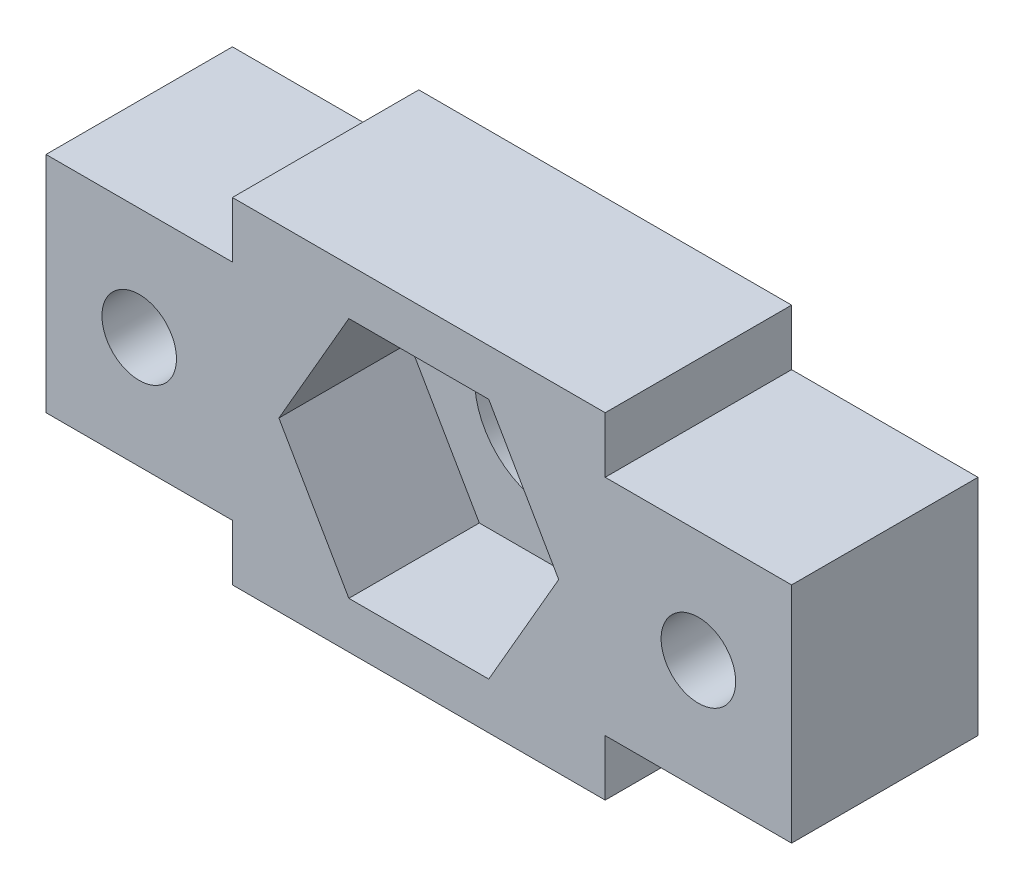
from build123d import *

# Parameters (mm, degrees)
SKETCH1_W           = 40
SKETCH1_H           = 12
SKETCH1_R           = 2
SKETCH1_R_2         = 4
BOSS_EXTRUDE1_DEPTH = 3
SKETCH2_W           = 20
SKETCH2_H           = 18
BOSS_EXTRUDE2_DEPTH = 7
SKETCH2_4_W         = 20
SKETCH2_4_H         = 18
BOSS_EXTRUDE3_DEPTH = 3
SKETCH3_W           = 10
SKETCH3_H           = 12
SKETCH3_R           = 2
BOSS_EXTRUDE4_DEPTH = 7
BOSS_EXTRUDE5_DEPTH = 3


with BuildPart() as part:
    # Sketch1 → Boss-Extrude1 (new body)
    with BuildSketch(Plane.XY):
        with Locations((-60, -25)):
            Rectangle(SKETCH1_W, SKETCH1_H)
        with Locations((-45, -25)):
            Circle(SKETCH1_R, mode=Mode.SUBTRACT)
        with Locations((-75, -25)):
            Circle(SKETCH1_R, mode=Mode.SUBTRACT)
        with Locations((-60, -25)):
            Circle(SKETCH1_R_2, mode=Mode.SUBTRACT)
    extrude(amount=BOSS_EXTRUDE1_DEPTH)

    # Sketch2 → Boss-Extrude2 (add)
    with BuildSketch(Plane.XY.offset(3)):
        with Locations((-60, -25)):
            Rectangle(SKETCH2_W, SKETCH2_H)
        Polygon((-56.24722325, -18.5), (-63.75277675, -18.5), (-67.505553499, -25), (-63.75277675, -31.5), (-56.24722325, -31.5), (-52.494446501, -25), align=None, mode=Mode.SUBTRACT)
    extrude(amount=BOSS_EXTRUDE2_DEPTH)

    # Sketch2<4> → Boss-Extrude3 (add)
    with BuildSketch(Plane.XY.offset(3)):
        with Locations((-60, -25)):
            Rectangle(SKETCH2_4_W, SKETCH2_4_H)
        Polygon((-56.24722325, -18.5), (-63.75277675, -18.5), (-67.505553499, -25), (-63.75277675, -31.5), (-56.24722325, -31.5), (-52.494446501, -25), align=None, mode=Mode.SUBTRACT)
    extrude(amount=-BOSS_EXTRUDE3_DEPTH)

    # Sketch3 → Boss-Extrude4 (add)
    # profile 1 of 6: a face of its own
    with BuildSketch(Plane.XY.offset(3)):
        Polygon((-50, -19), (-55.958548116, -19), (-52.494446501, -25), (-55.958548116, -31), (-50, -31), align=None)
    # profile 2 of 6: a face of its own
    with BuildSketch(Plane.XY.offset(3)):
        Polygon((-64.041451884, -31), (-70, -31), (-70, -34), (-50, -34), (-50, -31), (-55.958548116, -31), (-56.24722325, -31.5), (-63.75277675, -31.5), align=None)
    # profile 3 of 6: a face of its own
    with BuildSketch(Plane.XY.offset(3)):
        Polygon((-64.041451884, -19), (-70, -19), (-70, -31), (-64.041451884, -31), (-67.505553499, -25), align=None)
    # profile 4 of 6: a face of its own
    with BuildSketch(Plane.XY.offset(3)):
        Polygon((-70, -16), (-70, -19), (-64.041451884, -19), (-63.75277675, -18.5), (-56.24722325, -18.5), (-55.958548116, -19), (-50, -19), (-50, -16), align=None)
    # profile 5 of 6: a face of its own
    with BuildSketch(Plane.XY.offset(3)):
        with Locations((-75, -25)):
            Rectangle(SKETCH3_W, SKETCH3_H)
        with Locations((-75, -25)):
            Circle(SKETCH3_R, mode=Mode.SUBTRACT)
    # profile 6 of 6: a face of its own
    with BuildSketch(Plane.XY.offset(3)):
        with Locations((-45, -25)):
            Rectangle(SKETCH3_W, SKETCH3_H)
        with Locations((-45, -25)):
            Circle(SKETCH3_R, mode=Mode.SUBTRACT)
    extrude(amount=BOSS_EXTRUDE4_DEPTH)

    # Sketch3<4> → Boss-Extrude5 (add)
    with BuildSketch(Plane.XY.offset(3)):
        Polygon((-63.75277675, -18.5), (-64.041451884, -19), (-55.958548116, -19), (-56.24722325, -18.5), align=None)
        Polygon((-55.958548116, -31), (-64.041451884, -31), (-63.75277675, -31.5), (-56.24722325, -31.5), align=None)
    extrude(amount=-BOSS_EXTRUDE5_DEPTH)


solid = part.part
